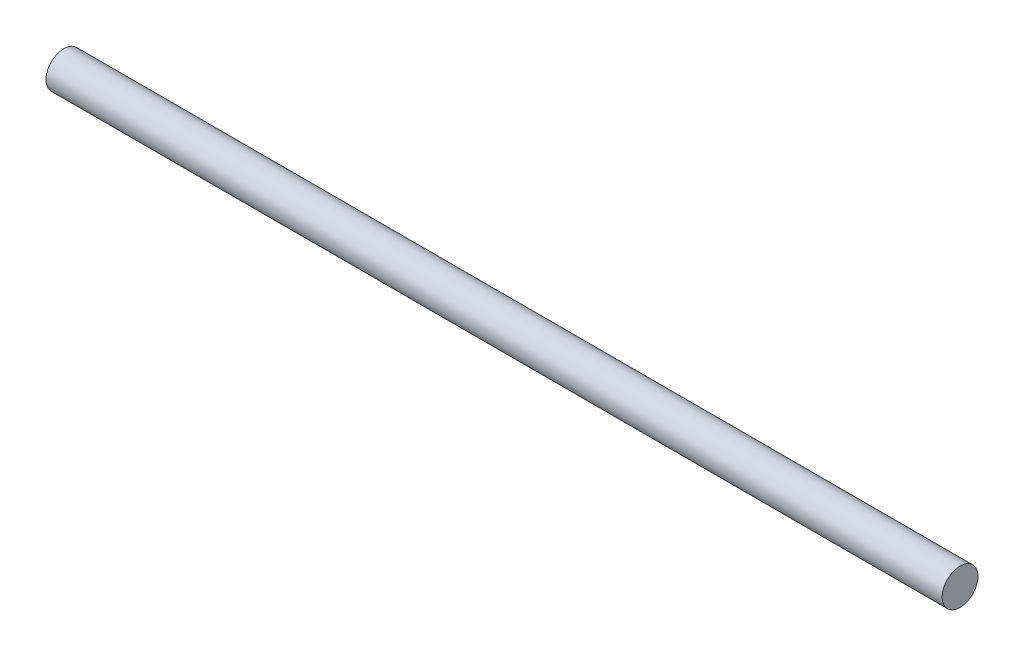
from build123d import *

# Parameters (mm, degrees)
CROQUIS1_R              = 10
SALIENTE_EXTRUIR1_DEPTH = 500


with BuildPart() as part:
    # Croquis1 → Saliente-Extruir1 (new body)
    with BuildSketch(Plane(origin=(0, 0, 0), x_dir=(0, 0, -1), z_dir=(1, 0, 0))):
        Circle(CROQUIS1_R)
    extrude(amount=SALIENTE_EXTRUIR1_DEPTH)


solid = part.part
